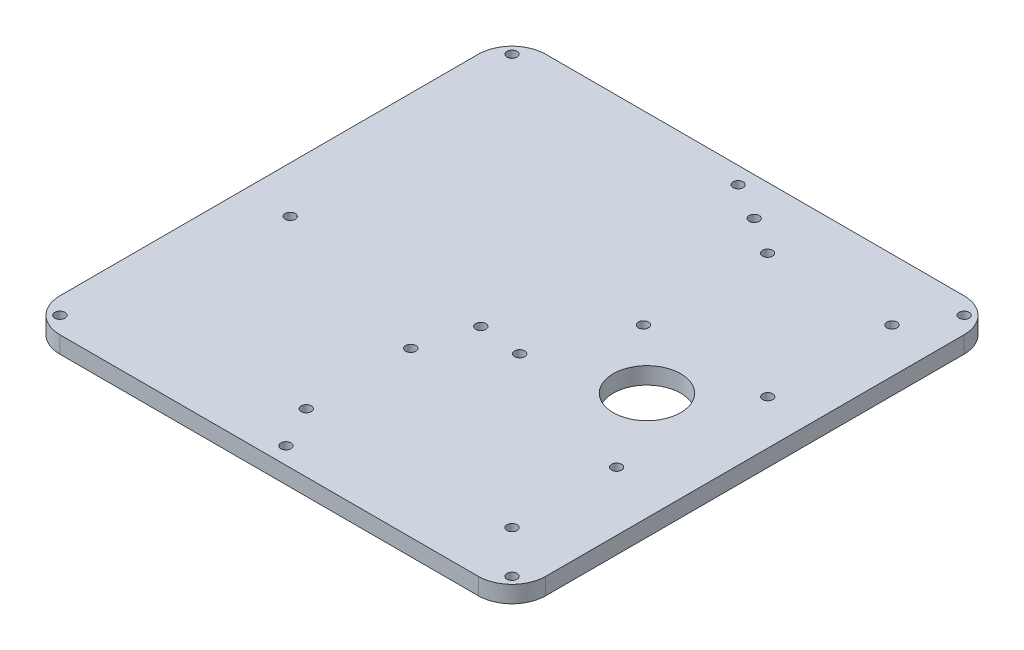
from build123d import *

# Parameters (mm, degrees)
SKETCH1_W           = 144
SKETCH1_H           = 144
BOSS_EXTRUDE1_DEPTH = 5
SKETCH2_R           = 1.5
CUT_EXTRUDE1_DEPTH  = 5
FILLET1_R           = 10
SKETCH3_R           = 1.5
CUT_EXTRUDE2_DEPTH  = 5
SKETCH4_R           = 1.5
CUT_EXTRUDE3_DEPTH  = 5
SKETCH6_R           = 10
CUT_EXTRUDE4_DEPTH  = 5
SKETCH7_R           = 1.5
CUT_EXTRUDE5_DEPTH  = 5
SKETCH8_R           = 1.5
CUT_EXTRUDE6_DEPTH  = 5


with BuildPart() as part:
    # Sketch1 → Boss-Extrude1 (new body)
    with BuildSketch(Plane(origin=(0, 0, 0), x_dir=(1, 0, 0), z_dir=(0, 1, 0))):
        Rectangle(SKETCH1_W, SKETCH1_H)
    extrude(amount=BOSS_EXTRUDE1_DEPTH)

    # Sketch2 → Cut-Extrude1 (cut)
    with BuildSketch(Plane(origin=(0, 5, 0), x_dir=(1, 0, 0), z_dir=(0, 1, 0))):
        with Locations(Location((-67, 67, 0), (0, 0, 270))):
            Circle(SKETCH2_R)
        with Locations(Location((-67, -67, 0), (0, 0, 270))):
            Circle(SKETCH2_R)
        with Locations(Location((67, 67, 0), (0, 0, 270))):
            Circle(SKETCH2_R)
        with Locations(Location((67, -67, 0), (0, 0, 270))):
            Circle(SKETCH2_R)
    extrude(amount=-CUT_EXTRUDE1_DEPTH, mode=Mode.SUBTRACT)

    # Fillet1
    fillet1_edges = [part.edges().sort_by_distance(p)[0] for p in [
        (72, 2.5, 72),
        (-72, 2.5, 72),
        (-72, 2.5, -72),
        (72, 2.5, -72),
    ]]
    fillet(fillet1_edges, radius=FILLET1_R)

    # Sketch3 → Cut-Extrude2 (cut)
    with BuildSketch(Plane.XZ):
        with Locations(Location((11.02, 8.75, 0), (0, 0, 270))):
            Circle(SKETCH3_R)
        with Locations(Location((11.02, -60.75, 0), (0, 0, 270))):
            Circle(SKETCH3_R)
    extrude(amount=-CUT_EXTRUDE2_DEPTH, mode=Mode.SUBTRACT)

    # Sketch4 → Cut-Extrude3 (cut)
    with BuildSketch(Plane(origin=(0, 5, 0), x_dir=(1, 0, 0), z_dir=(0, 1, 0))):
        with Locations(Location((21.95, 53.803699422, 0), (0, 0, 270))):
            Circle(SKETCH4_R)
        with Locations(Location((58.8, 53.803699422, 0), (0, 0, 270))):
            Circle(SKETCH4_R)
        with Locations(Location((21.95, 16.996300578, 0), (0, 0, 270))):
            Circle(SKETCH4_R)
        with Locations(Location((58.8, 16.996300578, 0), (0, 0, 270))):
            Circle(SKETCH4_R)
        with Locations(Location((-6.5, -23.5, 0), (0, 0, 270))):
            Circle(SKETCH4_R)
        with Locations(Location((54.5, -23.5, 0), (0, 0, 270))):
            Circle(SKETCH4_R)
        with Locations(Location((-6.5, -54.5, 0), (0, 0, 270))):
            Circle(SKETCH4_R)
        with Locations(Location((54.5, -54.5, 0), (0, 0, 270))):
            Circle(SKETCH4_R)
    extrude(amount=-CUT_EXTRUDE3_DEPTH, mode=Mode.SUBTRACT)

    # Sketch6 → Cut-Extrude4 (cut)
    with BuildSketch(Plane.XZ):
        with Locations(Location((40, 0, 0), (0, 0, 270))):
            Circle(SKETCH6_R)
    extrude(amount=-CUT_EXTRUDE4_DEPTH, mode=Mode.SUBTRACT)

    # Sketch7 → Cut-Extrude5 (cut)
    with BuildSketch(Plane(origin=(0, 5, 0), x_dir=(1, 0, 0), z_dir=(0, 1, 0))):
        with Locations(Location((-58.25, -7.5, 0), (0, 0, 270))):
            Circle(SKETCH7_R)
        with Locations(Location((-1.75, -7.5, 0), (0, 0, 270))):
            Circle(SKETCH7_R)
    extrude(amount=-CUT_EXTRUDE5_DEPTH, mode=Mode.SUBTRACT)

    # Sketch8 → Cut-Extrude6 (cut)
    with BuildSketch(Plane(origin=(0, 5, 0), x_dir=(1, 0, 0), z_dir=(0, 1, 0))):
        with Locations(Location((0, 67, 0), (0, 0, 270))):
            Circle(SKETCH8_R)
        with Locations(Location((0, -67, 0), (0, 0, 270))):
            Circle(SKETCH8_R)
    extrude(amount=-CUT_EXTRUDE6_DEPTH, mode=Mode.SUBTRACT)


solid = part.part
